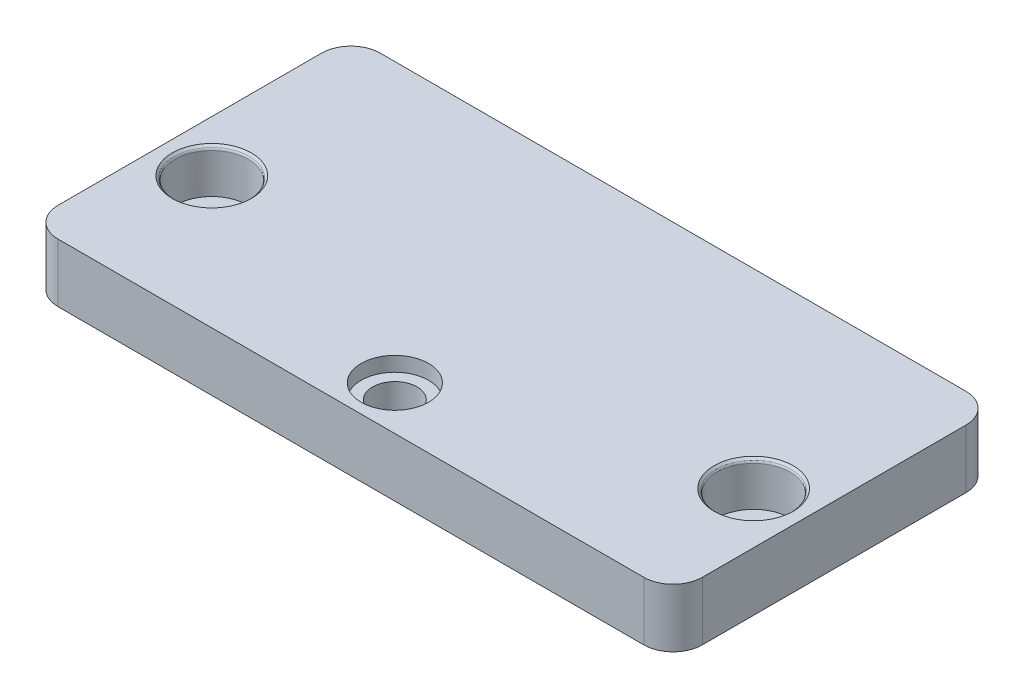
from build123d import *

# Parameters (mm, degrees)
SKETCH1_W           = 220
SKETCH1_H           = 110
BOSS_EXTRUDE1_DEPTH = 20
SKETCH2_R           = 12.5
SKETCH2_R_2         = 7.6
CUT_EXTRUDE1_DEPTH  = 15
CHAMFER1_SIZE       = 1
FILLET1_R           = 1
SKETCH4_R           = 11.5
CUT_EXTRUDE2_DEPTH  = 5
FILLET2_R           = 10


with BuildPart() as part:
    # Sketch1 → Boss-Extrude1 (new body)
    with BuildSketch(Plane(origin=(0, 0, 0), x_dir=(1, 0, 0), z_dir=(0, 1, 0))):
        with Locations((110, 55)):
            Rectangle(SKETCH1_W, SKETCH1_H)
    extrude(amount=BOSS_EXTRUDE1_DEPTH)

    # Sketch2 → Cut-Extrude1 (cut)
    with BuildSketch(Plane(origin=(0, 20, 0), x_dir=(1, 0, 0), z_dir=(0, 1, 0))):
        with Locations(Location((17.5, 45, 0), (0, 0, 270))):
            Circle(SKETCH2_R)
        with Locations(Location((202.5, 45, 0), (0, 0, 90))):
            Circle(SKETCH2_R)
        with Locations(Location((110, 15, 0), (0, 0, 270))):
            Circle(SKETCH2_R_2)
    extrude(amount=-CUT_EXTRUDE1_DEPTH, mode=Mode.SUBTRACT)

    # Chamfer1
    chamfer1_edges = [part.edges().sort_by_distance(p)[0] for p in [
        (17.5, 20, -57.5),
        (202.5, 20, -32.5),
    ]]
    chamfer(chamfer1_edges, length=CHAMFER1_SIZE)

    # Fillet1
    fillet1_edges = [part.edges().sort_by_distance(p)[0] for p in [
        (202.5, 19, -32.5),
        (17.5, 19, -57.5),
    ]]
    fillet(fillet1_edges, radius=FILLET1_R)

    # Sketch4 → Cut-Extrude2 (cut)
    with BuildSketch(Plane(origin=(0, 20, 0), x_dir=(1, 0, 0), z_dir=(0, 1, 0))):
        with Locations(Location((110, 15, 0), (0, 0, 270))):
            Circle(SKETCH4_R)
    extrude(amount=-CUT_EXTRUDE2_DEPTH, mode=Mode.SUBTRACT)

    # Fillet2
    fillet2_edges = [part.edges().sort_by_distance(p)[0] for p in [
        (0, 10, -110),
        (220, 10, -110),
        (220, 10, 0),
        (0, 10, 0),
    ]]
    fillet(fillet2_edges, radius=FILLET2_R)


solid = part.part
